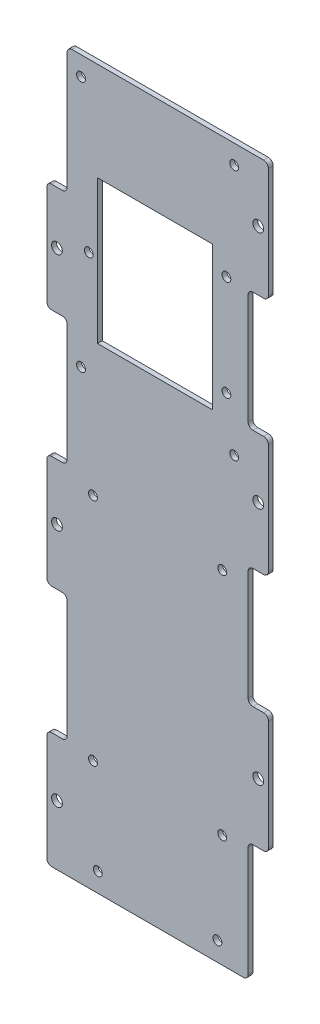
from build123d import *

# Parameters (mm, degrees)
SKETCH1_W           = 92.6
SKETCH1_H           = 300
BOSS_EXTRUDE1_DEPTH = 2
SKETCH2_R           = 2.25
SKETCH2_W           = 8.48
SKETCH2_H           = 53
SKETCH2_H_2         = 50
CUT_EXTRUDE5_DEPTH  = 10
FILLET3_R           = 2
SKETCH4_R           = 1.85
CUT_EXTRUDE6_DEPTH  = 10
SKETCH5_R           = 1.85
CUT_EXTRUDE7_DEPTH  = 5
SKETCH6_W           = 48
SKETCH6_H           = 60
CUT_EXTRUDE8_DEPTH  = 10


with BuildPart() as part:
    # Sketch1 → Boss-Extrude1 (new body)
    with BuildSketch(Plane.XY):
        Rectangle(SKETCH1_W, SKETCH1_H)
    extrude(amount=BOSS_EXTRUDE1_DEPTH)

    # Sketch2 → Cut-Extrude5 (cut)
    with BuildSketch(Plane.XY):
        with Locations((-42.06, 75)):
            Circle(SKETCH2_R)
        with Locations((42.06, 125)):
            Circle(SKETCH2_R)
        with Locations((42.06, 25)):
            Circle(SKETCH2_R)
        with Locations((42.06, -75)):
            Circle(SKETCH2_R)
        with Locations((-42.06, -25)):
            Circle(SKETCH2_R)
        with Locations((-42.06, -125)):
            Circle(SKETCH2_R)
        with Locations((-42.06, 123.5)):
            Rectangle(SKETCH2_W, SKETCH2_H)
        with Locations((42.06, 75)):
            Rectangle(SKETCH2_W, SKETCH2_H_2)
        with Locations((42.06, -25)):
            Rectangle(SKETCH2_W, SKETCH2_H_2)
        with Locations((-42.06, 25)):
            Rectangle(SKETCH2_W, SKETCH2_H)
        with Locations((-42.06, -75)):
            Rectangle(SKETCH2_W, SKETCH2_H)
        with Locations((42.06, -125)):
            Rectangle(SKETCH2_W, SKETCH2_H_2)
    extrude(amount=CUT_EXTRUDE5_DEPTH, mode=Mode.SUBTRACT)

    # Fillet3
    fillet3_edges = [part.edges().sort_by_distance(p)[0] for p in [
        (46.3, -100, 1),
        (37.82, -100, 1),
        (37.82, -150, 1),
        (46.3, 50, 1),
        (46.3, 100, 1),
        (37.82, 100, 1),
        (37.82, 50, 1),
        (-46.3, -48.5, 1),
        (-46.3, -101.5, 1),
        (-37.82, -101.5, 1),
        (-37.82, -48.5, 1),
        (37.82, 0, 1),
        (37.82, -50, 1),
        (46.3, -50, 1),
        (46.3, 0, 1),
        (46.3, 150, 1),
        (-46.3, -150, 1),
        (-46.3, 51.5, 1),
        (-46.3, -1.5, 1),
        (-37.82, -1.5, 1),
        (-37.82, 51.5, 1),
        (-46.3, 97, 1),
        (-37.82, 97, 1),
        (-37.82, 150, 1),
    ]]
    fillet(fillet3_edges, radius=FILLET3_R)

    # Sketch4 → Cut-Extrude6 (cut)
    with BuildSketch(Plane(origin=(0, 0, 0), x_dir=(-1, 0, 0), z_dir=(0, 0, -1))):
        with Locations((-25, -142)):
            Circle(SKETCH4_R)
        with Locations((25, -142)):
            Circle(SKETCH4_R)
        with Locations((32, 142)):
            Circle(SKETCH4_R)
        with Locations((-32, 142)):
            Circle(SKETCH4_R)
    extrude(amount=-CUT_EXTRUDE6_DEPTH, mode=Mode.SUBTRACT)

    # Sketch5 → Cut-Extrude7 (cut)
    with BuildSketch(Plane(origin=(0, 0, 0), x_dir=(-1, 0, 0), z_dir=(0, 0, -1))):
        with Locations((-27, -103)):
            Circle(SKETCH5_R)
        with Locations((27, -103)):
            Circle(SKETCH5_R)
        with Locations((-27, -7)):
            Circle(SKETCH5_R)
        with Locations((27, -7)):
            Circle(SKETCH5_R)
        with Locations((-32, 37)):
            Circle(SKETCH5_R)
        with Locations((32, 37)):
            Circle(SKETCH5_R)
        with Locations((-28.75, 58)):
            Circle(SKETCH5_R)
        with Locations((28.75, 80.08)):
            Circle(SKETCH5_R)
        with Locations((-28.75, 100)):
            Circle(SKETCH5_R)
    extrude(amount=-CUT_EXTRUDE7_DEPTH, mode=Mode.SUBTRACT)

    # Sketch6 → Cut-Extrude8 (cut)
    with BuildSketch(Plane(origin=(0, 0, 0), x_dir=(-1, 0, 0), z_dir=(0, 0, -1))):
        with Locations((1.1, 78.923300873)):
            Rectangle(SKETCH6_W, SKETCH6_H)
    extrude(amount=-CUT_EXTRUDE8_DEPTH, mode=Mode.SUBTRACT)


solid = part.part
